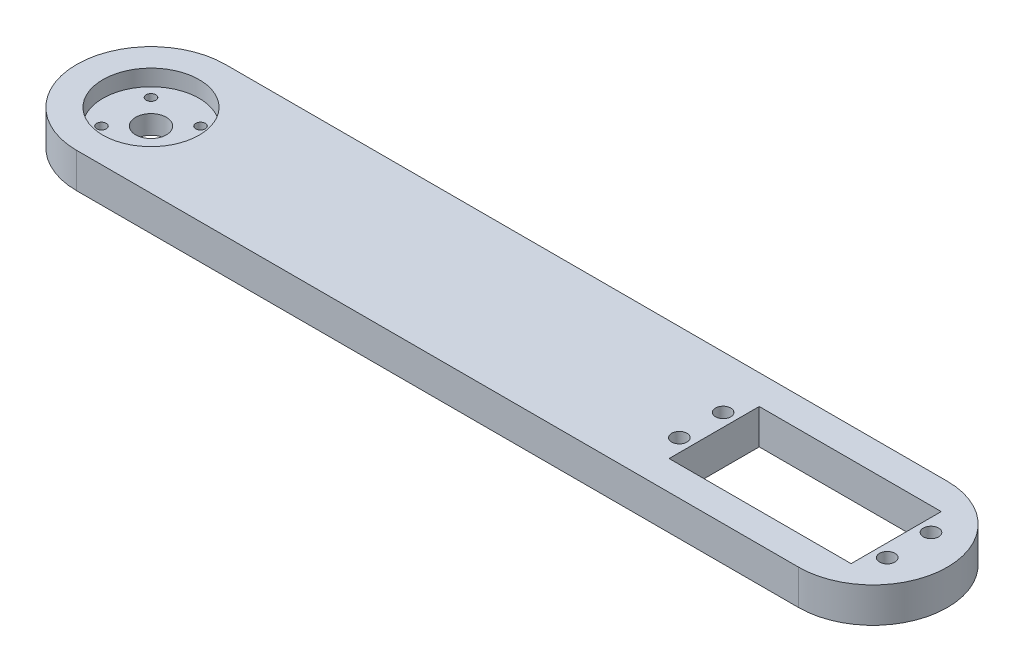
from build123d import *

# Parameters (mm, degrees)
ESTRUSIONE_ESTRUSIONE1_DEPTH  = 8
TAGLIO_ESTRUSIONE1_DEPTH      = 183.967210177
TAGLIO_ESTRUSIONE1_DEPTH_BACK = 183.967210177
SCHIZZO2_R                    = 3.5
SCHIZZO2_W                    = 41.6
SCHIZZO2_H                    = 20.6
SCHIZZO3_R                    = 11
TAGLIO_ESTRUSIONE2_DEPTH      = 3.7
SCHIZZO4_R                    = 1.1
TAGLIO_ESTRUSIONE3_DEPTH      = 3
SCHIZZO5_R                    = 1.75
TAGLIO_ESTRUSIONE4_DEPTH      = 183.967210177


with BuildPart() as part:
    # Schizzo1 → Estrusione-Estrusione1 (new body)
    with BuildSketch(Plane(origin=(0, 0, 0), x_dir=(1, 0, 0), z_dir=(0, 1, 0))):
        with BuildLine():
            Line((0, 17), (165, 17))
            ThreePointArc((165, 17), (182, 0), (165, -17))
            Line((165, -17), (0, -17))
            ThreePointArc((0, -17), (-17, 0), (0, 17))
        make_face()
    extrude(amount=ESTRUSIONE_ESTRUSIONE1_DEPTH)

    # Schizzo2 → Taglio-Estrusione1 (cut, two sides: drawn at the far end of the back side and taken through both)
    with BuildSketch(Plane.XZ.offset(-TAGLIO_ESTRUSIONE1_DEPTH_BACK)):
        with Locations(Location((0, 0, 0), (0, 0, 270))):
            Circle(SCHIZZO2_R)
        with Locations((149.5, 0)):
            Rectangle(SCHIZZO2_W, SCHIZZO2_H)
    extrude(amount=TAGLIO_ESTRUSIONE1_DEPTH + TAGLIO_ESTRUSIONE1_DEPTH_BACK, mode=Mode.SUBTRACT)

    # Schizzo3 → Taglio-Estrusione2 (cut)
    with BuildSketch(Plane(origin=(0, 8, 0), x_dir=(1, 0, 0), z_dir=(0, 1, 0))):
        with Locations(Location((0, 0, 0), (0, 0, 270))):
            Circle(SCHIZZO3_R)
    extrude(amount=-TAGLIO_ESTRUSIONE2_DEPTH, mode=Mode.SUBTRACT)

    # Schizzo4 → Taglio-Estrusione3 (cut)
    with BuildSketch(Plane(origin=(0, 4.3, 0), x_dir=(1, 0, 0), z_dir=(0, 1, 0))):
        with Locations(Location((-5.66, 5.66, 0), (0, 0, 270))):
            Circle(SCHIZZO4_R)
        with Locations(Location((5.66, 5.66, 0), (0, 0, 270))):
            Circle(SCHIZZO4_R)
        with Locations(Location((5.66, -5.66, 0), (0, 0, 270))):
            Circle(SCHIZZO4_R)
        with Locations(Location((-5.66, -5.66, 0), (0, 0, 270))):
            Circle(SCHIZZO4_R)
    extrude(amount=-TAGLIO_ESTRUSIONE3_DEPTH, mode=Mode.SUBTRACT)

    # Schizzo5 → Taglio-Estrusione4 (cut, through all)
    with BuildSketch(Plane(origin=(0, 8, 0), x_dir=(1, 0, 0), z_dir=(0, 1, 0))):
        with Locations(Location((125.75, 5, 0), (0, 0, 270))):
            Circle(SCHIZZO5_R)
        with Locations(Location((125.75, -5, 0), (0, 0, 270))):
            Circle(SCHIZZO5_R)
        with Locations(Location((173.25, -5, 0), (0, 0, 270))):
            Circle(SCHIZZO5_R)
        with Locations(Location((173.25, 5, 0), (0, 0, 270))):
            Circle(SCHIZZO5_R)
    extrude(amount=-TAGLIO_ESTRUSIONE4_DEPTH, mode=Mode.SUBTRACT)


solid = part.part
